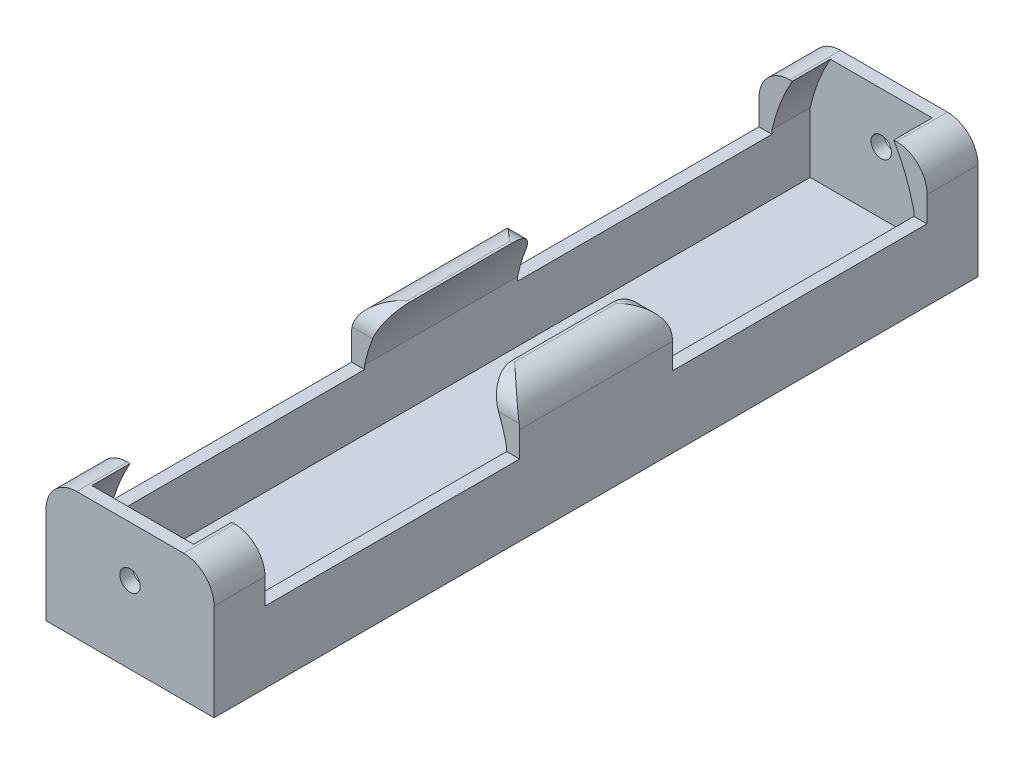
from build123d import *

# Parameters (mm, degrees)
BOSS_EXTRUDE1_DEPTH     = 30
CUT_EXTRUDE1_DEPTH      = 20
CUT_EXTRUDE1_DEPTH_BACK = 7
CUT_EXTRUDE3_START      = -0.5
CUT_EXTRUDE3_DEPTH      = 29
SKETCH4_R               = 0.4
CUT_EXTRUDE4_DEPTH      = 33


with BuildPart() as part:
    # Sketch1 → Boss-Extrude1 (new body)
    with BuildSketch(Plane.XY):
        with BuildLine():
            Line((-2.1, 1.334816112), (2.1, 1.334816112))
            ThreePointArc((2.1, 1.334816112), (2.948528137, 0.98334425), (3.3, 0.134816112))
            Line((3.3, 0.134816112), (3.3, -3.665183888))
            Line((3.3, -3.665183888), (-3.3, -3.665183888))
            Line((-3.3, -3.665183888), (-3.3, 0.134816112))
            ThreePointArc((-3.3, 0.134816112), (-2.948528137, 0.98334425), (-2.1, 1.334816112))
        make_face()
    extrude(amount=BOSS_EXTRUDE1_DEPTH)

    # Sketch2 → Cut-Extrude1 (cut, two sides: drawn at the far end of the back side and taken through both)
    with BuildSketch(Plane(origin=(0, 0, 0), x_dir=(0, 0, -1), z_dir=(1, 0, 0)).offset(-CUT_EXTRUDE1_DEPTH_BACK)):
        with BuildLine():
            Line((-2, 1.334816112), (-2, -0.865183888))
            Line((-2, -0.865183888), (-12, -0.865183888))
            Line((-12, -0.865183888), (-12, 0.334816112))
            ThreePointArc((-12, 0.334816112), (-12.292893219, 1.041922893), (-13, 1.334816112))
            Line((-13, 1.334816112), (-2, 1.334816112))
        make_face()
        with BuildLine():
            Line((-17, 1.334816112), (-28, 1.334816112))
            Line((-28, 1.334816112), (-28, -0.865183888))
            Line((-28, -0.865183888), (-18, -0.865183888))
            Line((-18, -0.865183888), (-18, 0.334816112))
            ThreePointArc((-18, 0.334816112), (-17.707106781, 1.041922893), (-17, 1.334816112))
        make_face()
    extrude(amount=CUT_EXTRUDE1_DEPTH + CUT_EXTRUDE1_DEPTH_BACK, mode=Mode.SUBTRACT)

    # Sketch3 → Cut-Extrude3 (cut)
    with BuildSketch(Plane(origin=(0, 0, 0), x_dir=(-1, 0, 0), z_dir=(0, 0, -1)).offset(CUT_EXTRUDE3_START)):
        with BuildLine():
            Line((-2.789484842, -3.082504219), (2.789484842, -3.082504219))
            Line((2.789484842, -3.082504219), (2.789484842, -0.711081704))
            add(Edge.make_bspline(
                [(2.789484842, -0.711081704), (2.547062941, 0.37267851), (1.996608014, 1.334816112)],
                knots=[0, 0, 0, 1, 1, 1], degree=2))
            Line((1.996608014, 1.334816112), (-1.996608014, 1.334816112))
            add(Edge.make_bspline(
                [(-2.789484842, -0.711081704), (-2.547062941, 0.37267851), (-1.996608014, 1.334816112)],
                knots=[0, 0, 0, 1, 1, 1], degree=2))
            Line((-2.789484842, -0.711081704), (-2.789484842, -3.082504219))
        make_face()
    extrude(amount=-CUT_EXTRUDE3_DEPTH, mode=Mode.SUBTRACT)

    # Sketch4 → Cut-Extrude4 (cut)
    with BuildSketch(Plane(origin=(0, 0, 0), x_dir=(-1, 0, 0), z_dir=(0, 0, -1))):
        with Locations((0, -0.646209964)):
            Circle(SKETCH4_R)
    extrude(amount=-CUT_EXTRUDE4_DEPTH, mode=Mode.SUBTRACT)


solid = part.part
